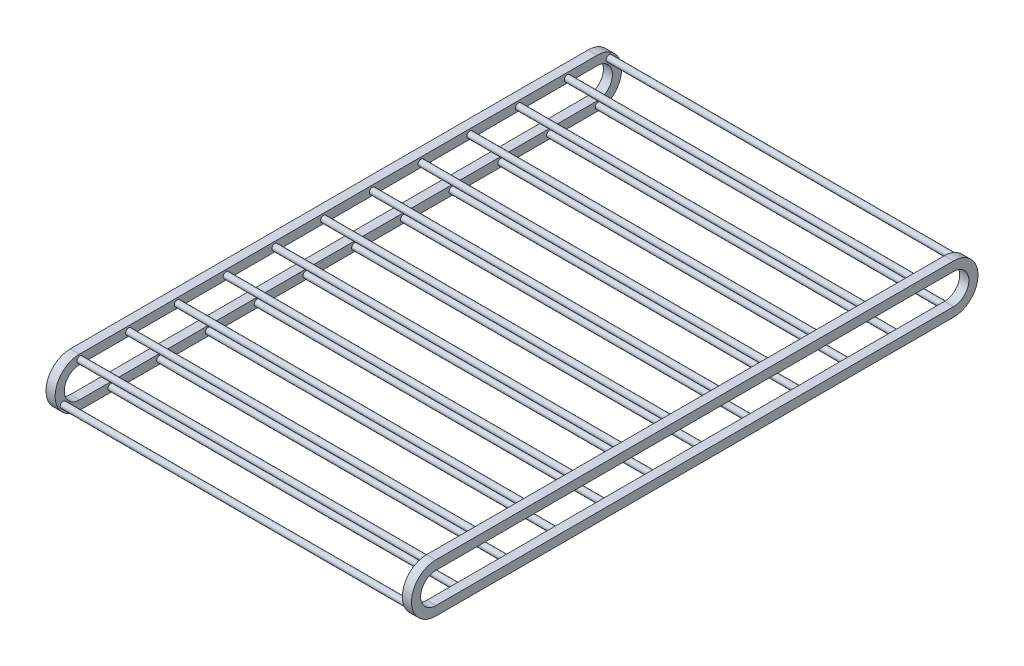
from build123d import *

# Parameters (mm, degrees)
SKETCH1_W           = 100
SKETCH1_H           = 100
BOSS_EXTRUDE1_DEPTH = 50
BOSS_EXTRUDE2_DEPTH = 30
SKETCH4_W           = 100
SKETCH4_H           = 30
BOSS_EXTRUDE3_DEPTH = 30
SKETCH5_W           = 50
SKETCH5_H           = 100
CUT_EXTRUDE1_DEPTH  = 110
LPATTERN1_COUNT     = 2
LPATTERN1_PITCH     = 1170
SKETCH6_R           = 10
BOSS_EXTRUDE4_DEPTH = 1160
LPATTERN2_COUNT     = 11
LPATTERN2_PITCH     = 160
SKETCH7_R           = 10
BOSS_EXTRUDE5_DEPTH = 1160
LPATTERN3_COUNT     = 11
LPATTERN3_PITCH     = 160
SKETCH8_R           = 10
BOSS_EXTRUDE6_DEPTH = 1160
SKETCH9_R           = 10
BOSS_EXTRUDE7_DEPTH = 1160


with BuildPart() as part:
    # Sketch1 → Boss-Extrude1 (new body)
    with BuildSketch(Plane(origin=(0, 0, 0), x_dir=(0, 0, -1), z_dir=(1, 0, 0))):
        with Locations((15.625, -21.033653846)):
            Rectangle(SKETCH1_W, SKETCH1_H)
    extrude(amount=BOSS_EXTRUDE1_DEPTH)



with BuildPart() as body_2:
    # Sketch3 → Boss-Extrude2 (new body)
    with BuildSketch(Plane(origin=(50, 0, 0), x_dir=(0, 0, -1), z_dir=(1, 0, 0))):
        with BuildLine():
            Line((-34.375, -13.682922568), (-34.375, 16.317077432))
            Line((-34.375, 16.317077432), (-746.477720281, 16.317077432))
            ThreePointArc((-746.477720281, 16.317077432), (-826.477720281, -63.682922568), (-746.477720281, -143.682922568))
            Line((-746.477720281, -143.682922568), (953.522279719, -143.682922568))
            ThreePointArc((953.522279719, -143.682922568), (1033.522279719, -63.682922568), (953.522279719, 16.317077432))
            Line((953.522279719, 16.317077432), (65.625, 16.317077432))
            Line((65.625, 16.317077432), (65.625, -13.682922568))
            Line((65.625, -13.682922568), (953.522279719, -13.682922568))
            ThreePointArc((953.522279719, -13.682922568), (1003.522279719, -63.682922568), (953.522279719, -113.682922568))
            Line((953.522279719, -113.682922568), (-746.477720281, -113.682922568))
            ThreePointArc((-746.477720281, -113.682922568), (-796.477720281, -63.682922568), (-746.477720281, -13.682922568))
            Line((-746.477720281, -13.682922568), (-34.375, -13.682922568))
        make_face()
    extrude(amount=BOSS_EXTRUDE2_DEPTH)


with BuildPart() as part_1:
    add(part.part)

    add(body_2.part)  # Boss-Extrude3 merges body 2
    # Sketch4 → Boss-Extrude3 (add)
    with BuildSketch(Plane(origin=(80, 0, 0), x_dir=(0, 0, -1), z_dir=(1, 0, 0))):
        with Locations((15.625, 1.317077432)):
            Rectangle(SKETCH4_W, SKETCH4_H)
    extrude(amount=-BOSS_EXTRUDE3_DEPTH)

    # Sketch5 → Cut-Extrude1 (cut)
    with BuildSketch(Plane(origin=(0, 28.966346154, 0), x_dir=(1, 0, 0), z_dir=(0, 1, 0))):
        with Locations((25, 15.625)):
            Rectangle(SKETCH5_W, SKETCH5_H)
    extrude(amount=-CUT_EXTRUDE1_DEPTH, mode=Mode.SUBTRACT)


with BuildPart() as lpattern1_1:
    # LPattern1: pattern copy
    add(part_1.part.moved(Location(Vector(1, 0, 0) * (1 * LPATTERN1_PITCH))))


with BuildPart() as part_2:
    add(part_1.part)

    add(lpattern1_1.part)  # Boss-Extrude4 merges LPattern1_1
    # Sketch6 → Boss-Extrude4 (add)
    with BuildSketch(Plane(origin=(80, 0, 0), x_dir=(0, 0, -1), z_dir=(1, 0, 0))):
        with Locations((-744.882973678, 0)):
            Circle(SKETCH6_R)
    boss_extrude4 = extrude(amount=BOSS_EXTRUDE4_DEPTH)

    # LPattern2: Boss-Extrude4 ×11
    with Locations(*[(0, 0, -i * LPATTERN2_PITCH) for i in range(1, LPATTERN2_COUNT)]):
        add(boss_extrude4)

    # Sketch7 → Boss-Extrude5 (add)
    with BuildSketch(Plane(origin=(80, 0, 0), x_dir=(0, 0, -1), z_dir=(1, 0, 0))):
        with Locations((956.928162623, -128.682922568)):
            Circle(SKETCH7_R)
    boss_extrude5 = extrude(amount=BOSS_EXTRUDE5_DEPTH)

    # LPattern3: Boss-Extrude5 ×11
    with Locations(*[(0, 0, i * LPATTERN3_PITCH) for i in range(1, LPATTERN3_COUNT)]):
        add(boss_extrude5)

    # Sketch8 → Boss-Extrude6 (add)
    with BuildSketch(Plane(origin=(80, 0, 0), x_dir=(0, 0, -1), z_dir=(1, 0, 0))):
        with Locations((-799.767519163, -100.901161848)):
            Circle(SKETCH8_R)
    extrude(amount=BOSS_EXTRUDE6_DEPTH)

    # Sketch9 → Boss-Extrude7 (add)
    with BuildSketch(Plane(origin=(80, 0, 0), x_dir=(0, 0, -1), z_dir=(1, 0, 0))):
        with Locations((992.567145138, -11.716601895)):
            Circle(SKETCH9_R)
    extrude(amount=BOSS_EXTRUDE7_DEPTH)


solid = part_2.part
